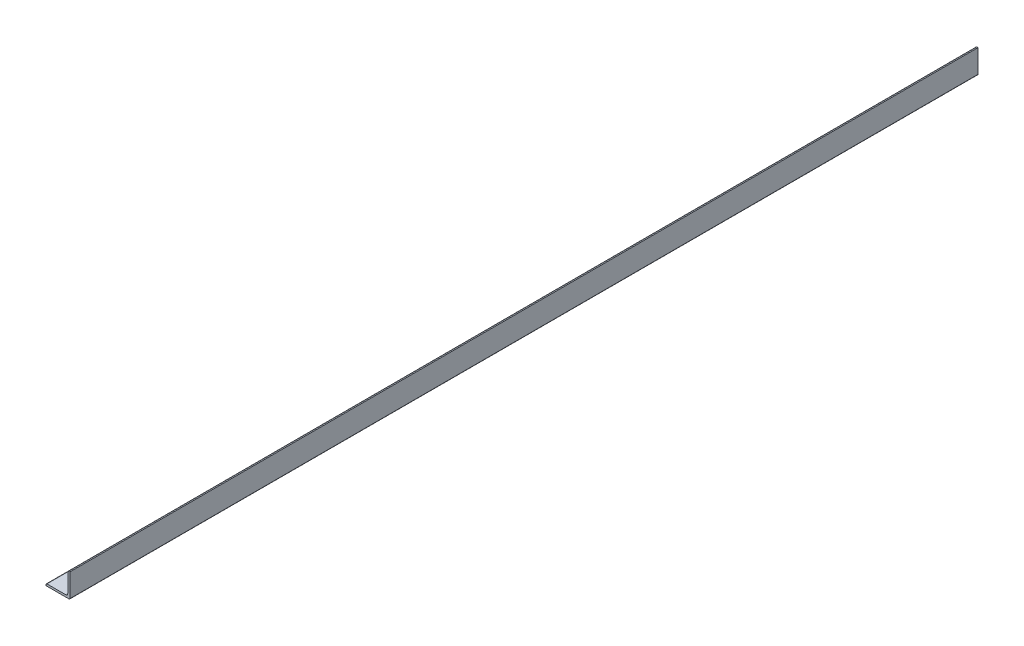
from build123d import *

# Parameters (mm, degrees)
BOSS_EXTRUDE1_DEPTH = 668
FILLET1_R           = 1.5


with BuildPart() as part:
    # Sketch1 → Boss-Extrude1 (new body)
    with BuildSketch(Plane.XY):
        with BuildLine():
            Line((-1, 0), (-35, 0))
            Line((-35, 0), (-35, 3))
            Line((-35, 3), (-6, 3))
            ThreePointArc((-6, 3), (-3.878679656, 3.878679656), (-3, 6))
            Line((-3, 6), (-3, 35))
            Line((-3, 35), (0, 35))
            Line((0, 35), (0, 1))
            ThreePointArc((0, 1), (-0.292893219, 0.292893219), (-1, 0))
        make_face()
    extrude(amount=BOSS_EXTRUDE1_DEPTH)

    # Fillet1
    fillet1_edges = [part.edges().sort_by_distance(p)[0] for p in [
        (-35, 3, 334),
        (-3, 35, 334),
    ]]
    fillet(fillet1_edges, radius=FILLET1_R)

    # Mirror4: part across plane


with BuildPart() as part_1:
    add(part.part)
    add(part.part.mirror(Plane.XY))


solid = part_1.part
